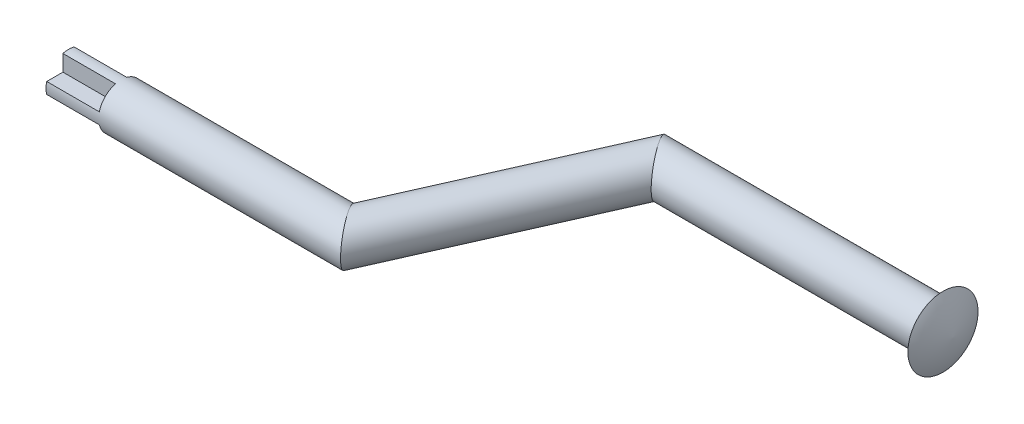
from build123d import *

# Parameters (mm, degrees)
SKETCH3_R          = 7.62
CUT_EXTRUDE3_DEPTH = 17.78
CUT_EXTRUDE4_DEPTH = 17.78


with BuildPart() as part:
    # Sweep1: sweep along a path in Sketch1
    with BuildLine(Plane(origin=(0, 0, 0), x_dir=(1, 0, 0), z_dir=(0, 1, 0))) as sweep1_path:
        Line((0, 0), (-95.984915269, 0))
        Line((-95.984915269, 0), (-128.252610358, -72.746173646))
        Line((-128.252610358, -72.746173646), (-222.882267399, -72.746173646))
    # Sketch3 → Sweep1 (sweep)
    with BuildSketch(Plane(origin=(0, 0, 0), x_dir=(0, 0, -1), z_dir=(1, 0, 0))):
        Circle(SKETCH3_R)
    sweep(path=sweep1_path.line, transition=Transition.RIGHT)

    # Sketch6 → Revolve1 (revolve)
    with BuildSketch(Plane(origin=(0, 0, 0), x_dir=(1, 0, 0), z_dir=(0, 1, 0))):
        with BuildLine():
            Line((0, 0), (0, 11.860460566))
            ThreePointArc((0, 11.860460566), (2.307736562, 6.103805999), (3.406950908, 0))
            Line((3.406950908, 0), (0, 0))
        make_face()
    revolve(axis=Axis((0, 0, 0), (1, 0, 0)))

    # Sketch4 → Cut-Extrude3 (cut)
    with BuildSketch(Plane.ZY.offset(222.882267399)):
        with BuildLine():
            Line((80.12420692, 1.905), (74.651173646, 1.905))
            Line((74.651173646, 1.905), (74.651173646, 7.378033275))
            ThreePointArc((74.651173646, 7.378033275), (78.134327318, 5.388153673), (80.12420692, 1.905))
        make_face()
    cut_extrude3 = extrude(amount=-CUT_EXTRUDE3_DEPTH, mode=Mode.SUBTRACT)

    # Mirror3: Cut-Extrude3 across plane
    add(cut_extrude3.mirror(Plane.ZX), mode=Mode.SUBTRACT)

    # Sketch5 → Cut-Extrude4 (cut)
    with BuildSketch(Plane.ZY.offset(222.882267399)):
        with BuildLine():
            Line((65.368140371, 1.905), (70.841173646, 1.905))
            Line((70.841173646, 1.905), (70.841173646, 7.378033275))
            ThreePointArc((70.841173646, 7.378033275), (67.358019973, 5.388153673), (65.368140371, 1.905))
        make_face()
    cut_extrude4 = extrude(amount=-CUT_EXTRUDE4_DEPTH, mode=Mode.SUBTRACT)

    # Mirror4: Cut-Extrude4 across plane
    add(cut_extrude4.mirror(Plane.ZX), mode=Mode.SUBTRACT)


solid = part.part
